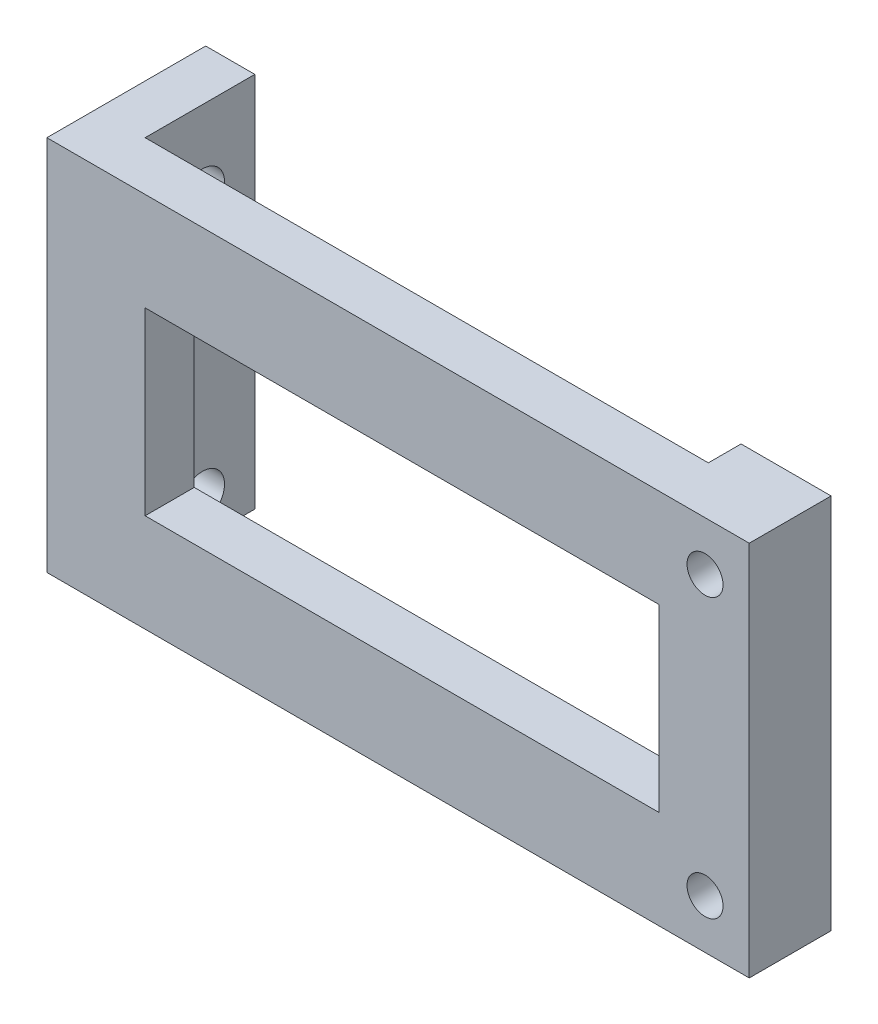
from build123d import *

# Parameters (mm, degrees)
BOSS_EXTRUDE1_DEPTH = 3
SKETCH1_3_R         = 1.1
BOSS_EXTRUDE2_DEPTH = 5
SKETCH1_4_W         = 3
SKETCH1_4_H         = 23
BOSS_EXTRUDE3_DEPTH = 9.7
SKETCH2_R           = 1.35
CUT_EXTRUDE1_DEPTH  = 3
LPATTERN1_COUNT     = 2
LPATTERN1_PITCH     = 16


with BuildPart() as part:
    # Sketch1 → Boss-Extrude1 (new body)
    with BuildSketch(Plane.XY):
        Polygon((15.95, 5.5), (15.95, 11.5), (-18.45, 11.5), (-18.45, -11.5), (15.95, -11.5), (15.95, -5.5), (-15.45, -5.5), (-15.45, 5.5), align=None)
    extrude(amount=-BOSS_EXTRUDE1_DEPTH)

    # Sketch1<3> → Boss-Extrude2 (add)
    with BuildSketch(Plane.XY):
        Polygon((21.45, -11.5), (21.45, 11.5), (15.95, 11.5), (15.95, 5.5), (15.95, -5.5), (15.95, -11.5), align=None)
        with Locations((18.75, -8.5)):
            Circle(SKETCH1_3_R, mode=Mode.SUBTRACT)
        with Locations((18.75, 8.5)):
            Circle(SKETCH1_3_R, mode=Mode.SUBTRACT)
    extrude(amount=-BOSS_EXTRUDE2_DEPTH)

    # Sketch1<4> → Boss-Extrude3 (add)
    with BuildSketch(Plane.XY):
        with Locations((-19.95, 0)):
            Rectangle(SKETCH1_4_W, SKETCH1_4_H)
    extrude(amount=-BOSS_EXTRUDE3_DEPTH)

    # Sketch2 → Cut-Extrude1 (cut)
    with BuildSketch(Plane.ZY.offset(21.45)):
        with Locations(Location((-6.5, 6.75, 0), (0, 0, 270))):
            Circle(SKETCH2_R)
    cut_extrude1 = extrude(amount=-CUT_EXTRUDE1_DEPTH, mode=Mode.SUBTRACT)

    # LPattern1: Cut-Extrude1 ×2
    with Locations(*[(0, -i * LPATTERN1_PITCH, 0) for i in range(1, LPATTERN1_COUNT)]):
        add(cut_extrude1, mode=Mode.SUBTRACT)


solid = part.part
